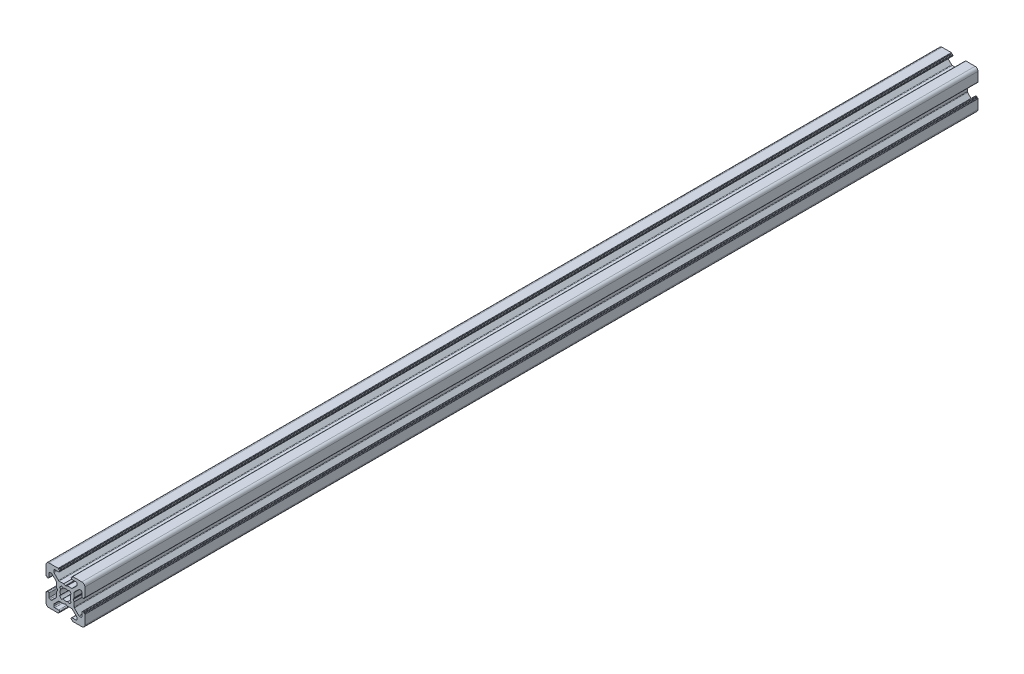
from build123d import *

# Parameters (mm, degrees)
Y_KSEKLIK_EKSTR_ZYON1_DEPTH = 230


with BuildPart() as part:
    # Çizim1 → Yükseklik-Ekstrüzyon1 (new, symmetric)
    with BuildSketch(Plane.XY):
        with BuildLine():
            Line((-3.750000227, 10), (-8.5, 10))
            ThreePointArc((-8.5, 10), (-9.560660172, 9.560660172), (-10, 8.5))
            Line((-10, 8.5), (-10, 3.749999605))
            ThreePointArc((-10, 3.749999605), (-9.941421356, 3.608578248), (-9.8, 3.549999605))
            Line((-9.8, 3.549999605), (-9.699999732, 3.549999605))
            ThreePointArc((-9.699999732, 3.549999605), (-9.558578376, 3.491420961), (-9.499999732, 3.349999605))
            Line((-9.499999732, 3.349999605), (-9.499999732, 3.2))
            ThreePointArc((-9.499999732, 3.2), (-9.441421088, 3.058578644), (-9.299999732, 3))
            Line((-9.299999732, 3), (-8.999999732, 3))
            ThreePointArc((-8.999999732, 3), (-8.646446341, 3.146446609), (-8.499999732, 3.5))
            Line((-8.499999732, 3.5), (-8.499999732, 5.499999605))
            ThreePointArc((-8.499999732, 5.499999605), (-8.353553123, 5.853552995), (-7.999999732, 5.999999605))
            Line((-7.999999732, 5.999999605), (-7.267766685, 5.999999605))
            ThreePointArc((-7.267766685, 5.999999605), (-7.076424969, 5.961939371), (-6.914213294, 5.853552995))
            Line((-6.914213294, 5.853552995), (-4.646446398, 3.585786099))
            ThreePointArc((-4.646446398, 3.585786099), (-4.538060023, 3.423574425), (-4.499999789, 3.232232709))
            Line((-4.499999789, 3.232232709), (-4.499999789, 0.953589302))
            ThreePointArc((-4.499999789, 0.953589302), (-4.493184953, 0.90182549), (-4.473204867, 0.853589298))
            Line((-4.473204867, 0.853589298), (-4.038119841, 0.099999969))
            ThreePointArc((-4.038119841, 0.099999969), (-4.011324929, 0), (-4.038119841, -0.099999969))
            Line((-4.038119841, -0.099999969), (-4.473204867, -0.853589297))
            ThreePointArc((-4.473204867, -0.853589297), (-4.493184953, -0.90182549), (-4.499999789, -0.953589302))
            Line((-4.499999789, -0.953589302), (-4.499999789, -3.232232708))
            ThreePointArc((-4.499999789, -3.232232708), (-4.538060023, -3.423574425), (-4.646446398, -3.585786099))
            Line((-4.646446398, -3.585786099), (-6.914213294, -5.853552995))
            ThreePointArc((-6.914213294, -5.853552995), (-7.076424969, -5.961939371), (-7.267766685, -5.999999605))
            Line((-7.267766685, -5.999999605), (-7.999999732, -5.999999605))
            ThreePointArc((-7.999999732, -5.999999605), (-8.353553123, -5.853552995), (-8.499999732, -5.499999605))
            Line((-8.499999732, -5.499999605), (-8.499999732, -3.5))
            ThreePointArc((-8.499999732, -3.5), (-8.646446341, -3.146446609), (-8.999999732, -3))
            Line((-8.999999732, -3), (-9.299999732, -3))
            ThreePointArc((-9.299999732, -3), (-9.441421088, -3.058578644), (-9.499999732, -3.2))
            Line((-9.499999732, -3.2), (-9.499999732, -3.349999605))
            ThreePointArc((-9.499999732, -3.349999605), (-9.558578376, -3.491420961), (-9.699999732, -3.549999605))
            Line((-9.699999732, -3.549999605), (-9.8, -3.549999605))
            ThreePointArc((-9.8, -3.549999605), (-9.941421356, -3.608578248), (-10, -3.749999605))
            Line((-10, -3.749999605), (-10, -8.5))
            ThreePointArc((-10, -8.5), (-9.560660172, -9.560660172), (-8.5, -10))
            Line((-8.5, -10), (-3.750000227, -10))
            ThreePointArc((-3.750000227, -10), (-3.608578871, -9.941421356), (-3.550000227, -9.8))
            Line((-3.550000227, -9.8), (-3.550000227, -9.7))
            ThreePointArc((-3.550000227, -9.7), (-3.491421584, -9.558578644), (-3.350000227, -9.5))
            Line((-3.350000227, -9.5), (-3.2, -9.5))
            ThreePointArc((-3.2, -9.5), (-3.058578644, -9.441421356), (-3, -9.3))
            Line((-3, -9.3), (-3, -8.999999673))
            ThreePointArc((-3, -8.999999673), (-3.146446609, -8.646446283), (-3.5, -8.499999673))
            Line((-3.5, -8.499999673), (-5.500000686, -8.499999673))
            ThreePointArc((-5.500000686, -8.499999673), (-5.853554077, -8.353553064), (-6.000000686, -7.999999673))
            Line((-6.000000686, -7.999999673), (-6.000000686, -7.267766626))
            ThreePointArc((-6.000000686, -7.267766626), (-5.961940448, -7.076424899), (-5.853554059, -6.914213219))
            Line((-5.853554059, -6.914213219), (-3.585787212, -4.646446592))
            ThreePointArc((-3.585787212, -4.646446592), (-3.423575544, -4.538060229), (-3.232233839, -4.5))
            Line((-3.232233839, -4.5), (-0.953590312, -4.5))
            ThreePointArc((-0.953590312, -4.5), (-0.901826505, -4.493185166), (-0.853590316, -4.473205083))
            Line((-0.853590316, -4.473205083), (-0.100000045, -4.038119562))
            ThreePointArc((-0.100000045, -4.038119562), (0, -4.011324632), (0.100000045, -4.038119562))
            Line((0.100000045, -4.038119562), (0.853590316, -4.473205083))
            ThreePointArc((0.853590316, -4.473205083), (0.901826505, -4.493185166), (0.953590312, -4.5))
            Line((0.953590312, -4.5), (3.232233839, -4.5))
            ThreePointArc((3.232233839, -4.5), (3.423575544, -4.538060229), (3.585787212, -4.646446592))
            Line((3.585787212, -4.646446592), (5.853554059, -6.914213218))
            ThreePointArc((5.853554059, -6.914213218), (5.961940448, -7.076424899), (6.000000686, -7.267766626))
            Line((6.000000686, -7.267766626), (6.000000686, -7.999999673))
            ThreePointArc((6.000000686, -7.999999673), (5.853554077, -8.353553064), (5.500000686, -8.499999673))
            Line((5.500000686, -8.499999673), (3.5, -8.499999673))
            ThreePointArc((3.5, -8.499999673), (3.146446609, -8.646446283), (3, -8.999999673))
            Line((3, -8.999999673), (3, -9.3))
            ThreePointArc((3, -9.3), (3.058578644, -9.441421356), (3.2, -9.5))
            Line((3.2, -9.5), (3.350000228, -9.5))
            ThreePointArc((3.350000228, -9.5), (3.491421584, -9.558578644), (3.550000228, -9.7))
            Line((3.550000228, -9.7), (3.550000228, -9.8))
            ThreePointArc((3.550000228, -9.8), (3.608578871, -9.941421356), (3.750000228, -10))
            Line((3.750000228, -10), (8.5, -10))
            ThreePointArc((8.5, -10), (9.560660172, -9.560660172), (10, -8.5))
            Line((10, -8.5), (10, -3.749999605))
            ThreePointArc((10, -3.749999605), (9.941421356, -3.608578248), (9.8, -3.549999605))
            Line((9.8, -3.549999605), (9.699999732, -3.549999605))
            ThreePointArc((9.699999732, -3.549999605), (9.558578376, -3.491420961), (9.499999732, -3.349999605))
            Line((9.499999732, -3.349999605), (9.499999732, -3.2))
            ThreePointArc((9.499999732, -3.2), (9.441421088, -3.058578644), (9.299999732, -3))
            Line((9.299999732, -3), (8.999999732, -3))
            ThreePointArc((8.999999732, -3), (8.646446341, -3.146446609), (8.499999732, -3.5))
            Line((8.499999732, -3.5), (8.499999732, -5.499999605))
            ThreePointArc((8.499999732, -5.499999605), (8.353553123, -5.853552995), (7.999999732, -5.999999605))
            Line((7.999999732, -5.999999605), (7.267766685, -5.999999605))
            ThreePointArc((7.267766685, -5.999999605), (7.076424969, -5.961939371), (6.914213294, -5.853552995))
            Line((6.914213294, -5.853552995), (4.646446398, -3.585786099))
            ThreePointArc((4.646446398, -3.585786099), (4.538060023, -3.423574425), (4.499999789, -3.232232708))
            Line((4.499999789, -3.232232708), (4.499999789, -0.953589302))
            ThreePointArc((4.499999789, -0.953589302), (4.493184953, -0.90182549), (4.473204867, -0.853589297))
            Line((4.473204867, -0.853589297), (4.038119841, -0.099999969))
            ThreePointArc((4.038119841, -0.099999969), (4.011324929, 0), (4.038119841, 0.099999969))
            Line((4.038119841, 0.099999969), (4.473204867, 0.853589298))
            ThreePointArc((4.473204867, 0.853589298), (4.493184953, 0.90182549), (4.499999789, 0.953589302))
            Line((4.499999789, 0.953589302), (4.499999789, 3.232232709))
            ThreePointArc((4.499999789, 3.232232709), (4.538060023, 3.423574425), (4.646446398, 3.585786099))
            Line((4.646446398, 3.585786099), (6.914213294, 5.853552995))
            ThreePointArc((6.914213294, 5.853552995), (7.076424969, 5.961939371), (7.267766685, 5.999999605))
            Line((7.267766685, 5.999999605), (7.999999732, 5.999999605))
            ThreePointArc((7.999999732, 5.999999605), (8.353553123, 5.853552995), (8.499999732, 5.499999605))
            Line((8.499999732, 5.499999605), (8.499999732, 3.5))
            ThreePointArc((8.499999732, 3.5), (8.646446341, 3.146446609), (8.999999732, 3))
            Line((8.999999732, 3), (9.299999732, 3))
            ThreePointArc((9.299999732, 3), (9.441421088, 3.058578644), (9.499999732, 3.2))
            Line((9.499999732, 3.2), (9.499999732, 3.349999605))
            ThreePointArc((9.499999732, 3.349999605), (9.558578376, 3.491420961), (9.699999732, 3.549999605))
            Line((9.699999732, 3.549999605), (9.8, 3.549999605))
            ThreePointArc((9.8, 3.549999605), (9.941421356, 3.608578248), (10, 3.749999605))
            Line((10, 3.749999605), (10, 8.5))
            ThreePointArc((10, 8.5), (9.560660172, 9.560660172), (8.5, 10))
            Line((8.5, 10), (3.750000228, 10))
            ThreePointArc((3.750000228, 10), (3.608578871, 9.941421356), (3.550000228, 9.8))
            Line((3.550000228, 9.8), (3.550000228, 9.7))
            ThreePointArc((3.550000228, 9.7), (3.491421584, 9.558578644), (3.350000228, 9.5))
            Line((3.350000228, 9.5), (3.2, 9.5))
            ThreePointArc((3.2, 9.5), (3.058578644, 9.441421356), (3, 9.3))
            Line((3, 9.3), (3, 8.999999673))
            ThreePointArc((3, 8.999999673), (3.146446609, 8.646446283), (3.5, 8.499999673))
            Line((3.5, 8.499999673), (5.500000686, 8.499999673))
            ThreePointArc((5.500000686, 8.499999673), (5.853554077, 8.353553064), (6.000000686, 7.999999673))
            Line((6.000000686, 7.999999673), (6.000000686, 7.267766626))
            ThreePointArc((6.000000686, 7.267766626), (5.961940448, 7.076424899), (5.853554059, 6.914213219))
            Line((5.853554059, 6.914213219), (3.585787212, 4.646446592))
            ThreePointArc((3.585787212, 4.646446592), (3.423575544, 4.538060229), (3.232233839, 4.5))
            Line((3.232233839, 4.5), (0.953590312, 4.5))
            ThreePointArc((0.953590312, 4.5), (0.901826505, 4.493185166), (0.853590316, 4.473205083))
            Line((0.853590316, 4.473205083), (0.100000045, 4.038119562))
            ThreePointArc((0.100000045, 4.038119562), (0, 4.011324632), (-0.100000045, 4.038119562))
            Line((-0.100000045, 4.038119562), (-0.853590316, 4.473205083))
            ThreePointArc((-0.853590316, 4.473205083), (-0.901826505, 4.493185166), (-0.953590312, 4.5))
            Line((-0.953590312, 4.5), (-3.232233839, 4.5))
            ThreePointArc((-3.232233839, 4.5), (-3.423575544, 4.538060229), (-3.585787212, 4.646446592))
            Line((-3.585787212, 4.646446592), (-5.853554059, 6.914213219))
            ThreePointArc((-5.853554059, 6.914213219), (-5.961940448, 7.076424899), (-6.000000686, 7.267766626))
            Line((-6.000000686, 7.267766626), (-6.000000686, 7.999999673))
            ThreePointArc((-6.000000686, 7.999999673), (-5.853554077, 8.353553064), (-5.500000686, 8.499999673))
            Line((-5.500000686, 8.499999673), (-3.5, 8.499999673))
            ThreePointArc((-3.5, 8.499999673), (-3.146446609, 8.646446283), (-3, 8.999999673))
            Line((-3, 8.999999673), (-3, 9.3))
            ThreePointArc((-3, 9.3), (-3.058578644, 9.441421356), (-3.2, 9.5))
            Line((-3.2, 9.5), (-3.350000227, 9.5))
            ThreePointArc((-3.350000227, 9.5), (-3.491421584, 9.558578644), (-3.550000227, 9.7))
            Line((-3.550000227, 9.7), (-3.550000227, 9.8))
            ThreePointArc((-3.550000227, 9.8), (-3.608578871, 9.941421356), (-3.750000227, 10))
        make_face()
        with BuildLine():
            Line((-2.992174953, 1.909930962), (-2.445295424, 1.258185317))
            ThreePointArc((-2.445295424, 1.258185317), (-2.75, 0), (-2.445295424, -1.258185317))
            Line((-2.445295424, -1.258185317), (-2.992174953, -1.909930962))
            ThreePointArc((-2.992174953, -1.909930962), (-2.511737261, -2.508410485), (-1.913895019, -2.989640962))
            Line((-1.913895019, -2.989640962), (-1.258185436, -2.445295362))
            ThreePointArc((-1.258185436, -2.445295362), (0, -2.75), (1.258185436, -2.445295362))
            Line((1.258185436, -2.445295362), (1.91389502, -2.989640962))
            ThreePointArc((1.91389502, -2.989640962), (2.511737261, -2.508410485), (2.992174953, -1.909930962))
            Line((2.992174953, -1.909930962), (2.445295424, -1.258185317))
            ThreePointArc((2.445295424, -1.258185317), (2.75, 0), (2.445295424, 1.258185317))
            Line((2.445295424, 1.258185317), (2.992174953, 1.909930962))
            ThreePointArc((2.992174953, 1.909930962), (2.511737261, 2.508410485), (1.91389502, 2.989640962))
            Line((1.91389502, 2.989640962), (1.258185436, 2.445295362))
            ThreePointArc((1.258185436, 2.445295362), (0, 2.75), (-1.258185436, 2.445295362))
            Line((-1.258185436, 2.445295362), (-1.913895019, 2.989640962))
            ThreePointArc((-1.913895019, 2.989640962), (-2.511737261, 2.508410485), (-2.992174953, 1.909930962))
        make_face(mode=Mode.SUBTRACT)
    extrude(amount=Y_KSEKLIK_EKSTR_ZYON1_DEPTH, both=True)


solid = part.part
